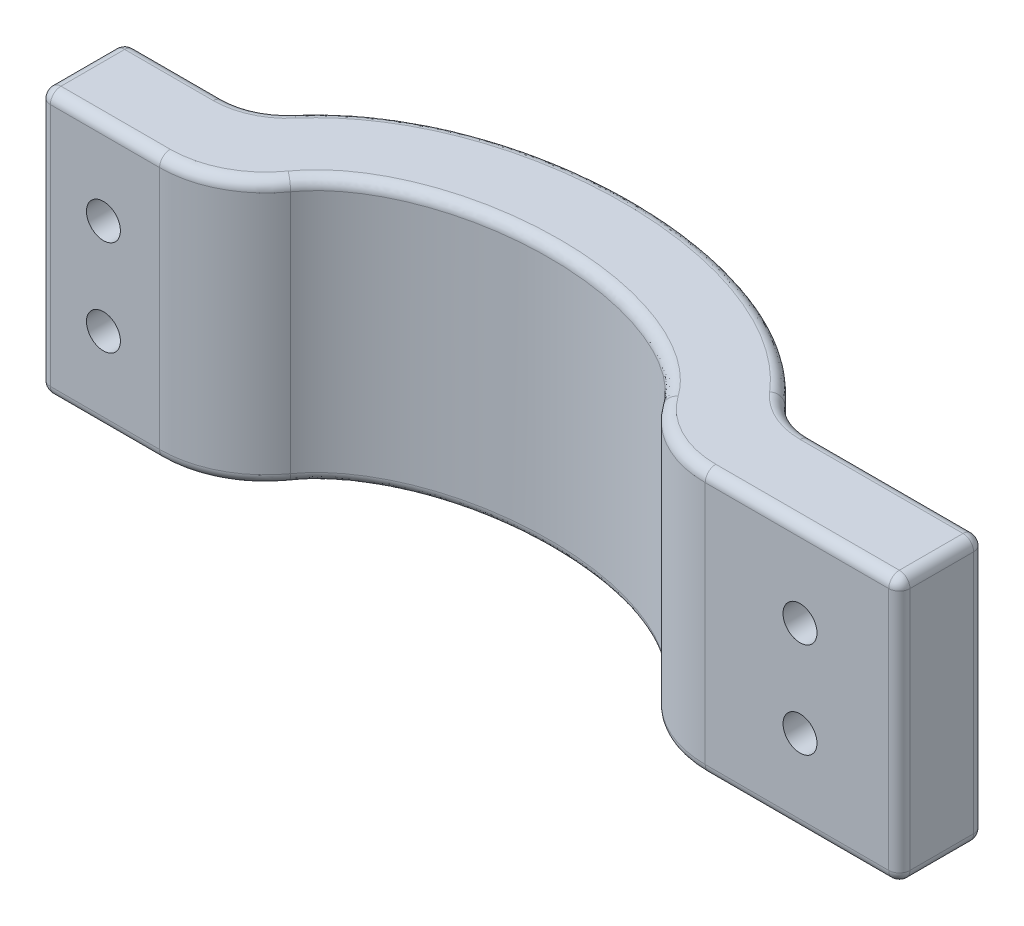
from build123d import *

# Parameters (mm, degrees)
BOSS_EXTRUDE2_DEPTH = 25
SKETCH3_R           = 1.6
CUT_EXTRUDE1_DEPTH  = 52.788029659
FILLET1_R           = 10
FILLET2_R           = 6
FILLET3_R           = 1


with BuildPart() as part:
    # Sketch1 → Boss-Extrude2 (new body)
    with BuildSketch(Plane(origin=(0, 0, 0), x_dir=(1, 0, 0), z_dir=(0, 1, 0))):
        with BuildLine():
            Line((-37, 8), (-24.639344689, 8))
            add(Edge.make_bspline(
                [(24.639344689, 8), (24.454166264, 8.295456695), (23.408912819, 9.852800295), (21.127343668, 12.282393762), (16.303949128, 15.64618527), (9.277524609, 18.296136919), (0, 19.351931541), (-9.277524609, 18.296136919), (-16.303949128, 15.64618527), (-21.127343668, 12.282393762), (-23.408912819, 9.852800295), (-24.454166264, 8.295456695), (-24.639344689, 8)],
                knots=[0.348100713, 0.348100713, 0.348100713, 0.348100713, 0.392699082, 0.589048623, 0.785398163, 1.178097245, 1.570796327, 1.963495408, 2.35619449, 2.552544031, 2.748893572, 2.793491941, 2.793491941, 2.793491941, 2.793491941], degree=3))
            Line((24.639344689, 8), (44, 8))
            Line((44, 8), (44, 0))
            Line((44, 0), (19, 0))
            add(Edge.make_bspline(
                [(19, 0), (19, 11), (0, 11), (-19, 11), (-19, 0)],
                knots=[0, 0, 0, 1.570796327, 1.570796327, 3.141592654, 3.141592654, 3.141592654], degree=2, weights=[1, 0.707106781, 1, 0.707106781, 1]))
            Line((-19, 0), (-37, 0))
            Line((-37, 0), (-37, 8))
        make_face()
    extrude(amount=BOSS_EXTRUDE2_DEPTH)

    # Sketch3 → Cut-Extrude1 (cut, through all)
    with BuildSketch(Plane(origin=(0, 0, -8), x_dir=(-1, 0, 0), z_dir=(0, 0, -1))):
        with Locations((31, 17)):
            Circle(SKETCH3_R)
        with Locations((31, 8)):
            Circle(SKETCH3_R)
        with Locations((-34.639344689, 17)):
            Circle(SKETCH3_R)
        with Locations((-34.639344689, 8)):
            Circle(SKETCH3_R)
    extrude(amount=-CUT_EXTRUDE1_DEPTH, mode=Mode.SUBTRACT)

    # Fillet1
    fillet1_edges = [part.edges().sort_by_distance(p)[0] for p in [
        (-19, 12.5, 0),
        (19, 12.5, 0),
    ]]
    fillet(fillet1_edges, radius=FILLET1_R)

    # Fillet2
    fillet2_edges = [part.edges().sort_by_distance(p)[0] for p in [
        (-24.639344689, 12.5, -8),
        (24.639344689, 12.5, -8),
    ]]
    fillet(fillet2_edges, radius=FILLET2_R)

    # Fillet3
    fillet3_edges = [part.edges().sort_by_distance(p)[0] for p in [
        (35.825286316, 0, -8),
        (44, 0, -4),
        (44, 25, -4),
        (-37, 12.5, 0),
        (-37, 12.5, -8),
        (44, 12.5, -8),
        (44, 12.5, 0),
        (35.825286316, 25, -8),
        (-37, 25, -4),
        (-29.4, 8, -8),
        (36.239344689, 17, -8),
        (-31.353339822, 25, 0),
        (36.239344689, 8, -8),
        (-29.4, 17, -8),
        (0, 0, -11),
        (0, 25, -11),
        (34.853339822, 0, 0),
        (21.126341345, 0, -1.110652382),
        (-21.126341345, 0, -1.110652382),
        (34.853339822, 25, 0),
        (21.126341345, 25, -1.110652382),
        (-21.126341345, 25, -1.110652382),
        (-32.325286316, 0, -8),
        (-32.325286316, 25, -8),
        (0, 0, -11),
        (0, 25, -11),
        (-25.142921121, 0, -8.549157506),
        (-25.142921121, 25, -8.549157506),
        (25.142921121, 0, -8.549157506),
        (25.142921121, 25, -8.549157506),
        (-31.353339822, 0, 0),
        (-37, 0, -4),
    ]]
    fillet(fillet3_edges, radius=FILLET3_R)


solid = part.part
